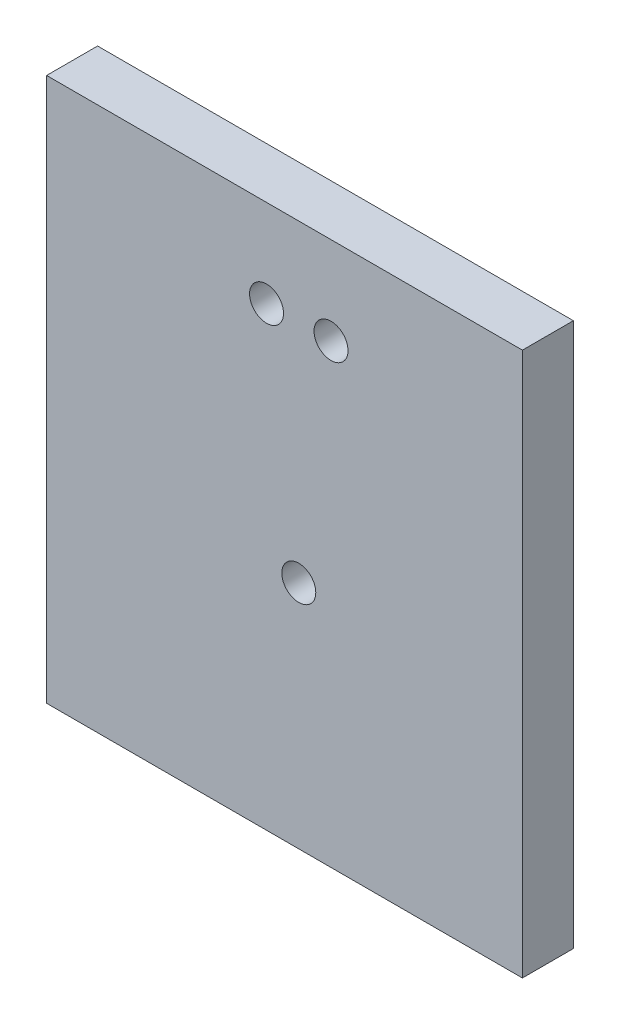
from build123d import *

# Parameters (mm, degrees)
SKETCH1_W                   = 88.9
SKETCH1_H                   = 101.6
BOSS_EXTRUDE1_DEPTH         = 9.525
F_1_4_0_25_DIAMETER_HOLE1_D = 6.35
F_1_4_0_25_DIAMETER_HOLE2_D = 6.35


with BuildPart() as part:
    # Sketch1 → Boss-Extrude1 (new body)
    with BuildSketch(Plane.XY):
        with Locations((-44.45, 50.8)):
            Rectangle(SKETCH1_W, SKETCH1_H)
    extrude(amount=BOSS_EXTRUDE1_DEPTH)

    # 1/4 (0.25) Diameter Hole1 (through all)
    with Locations(Plane.XY.offset(9.525)):
        with Locations((-35.759581135, 85.220282149), (-41.783720078, 43.051309551)):
            Hole(F_1_4_0_25_DIAMETER_HOLE1_D / 2)

    # 1/4 (0.25) Diameter Hole2 (through all)
    with Locations(Plane.XY.offset(9.525)):
        with Locations((-47.80785902, 85.220282149)):
            Hole(F_1_4_0_25_DIAMETER_HOLE2_D / 2)


solid = part.part
